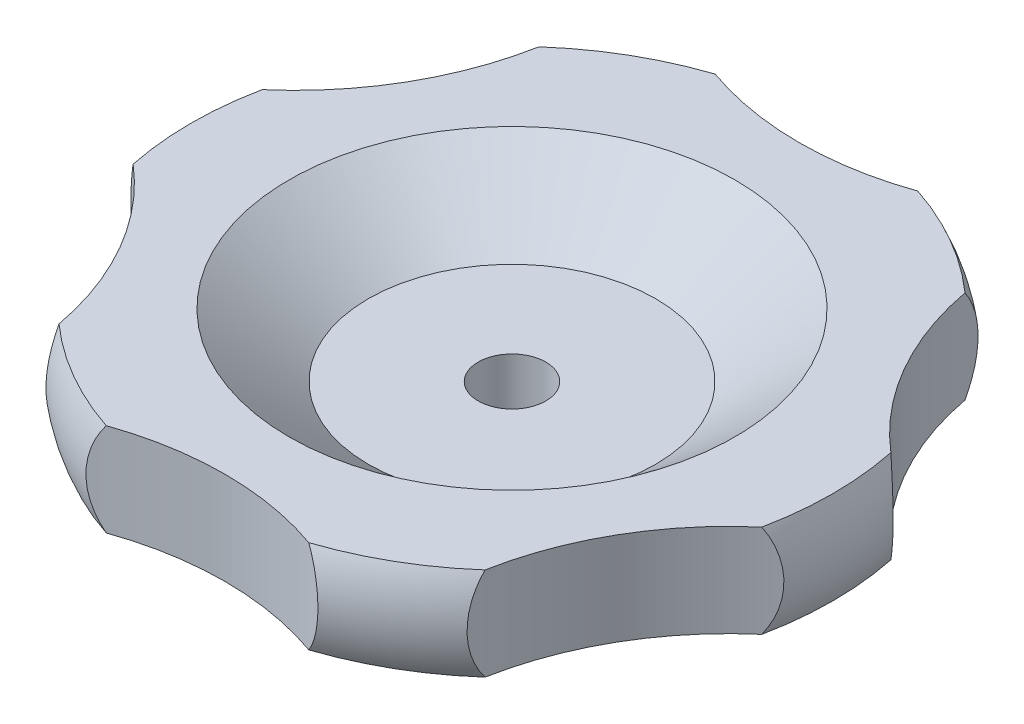
from build123d import *

# Parameters (mm, degrees)
ENL_V_MAT_EXTRU_1_DEPTH      = 59.776504379
R_P_TITION_CIRCULAIRE1_COUNT = 6


with BuildPart() as part:
    # Esquisse1 → Révolution1 (revolve)
    with BuildSketch(Plane.XY):
        with BuildLine():
            Line((-4, 12), (-4, 0))
            Line((-4, 0), (-13, 0))
            Line((-13, 0), (-13, 1.5))
            Line((-13, 1.5), (-18, 1.5))
            ThreePointArc((-18, 1.5), (-20.050252532, 6.449747468), (-25, 8.5))
            Line((-25, 8.5), (-38, 8.5))
            ThreePointArc((-38, 8.5), (-39.207317246, 14), (-38, 19.5))
            Line((-38, 19.5), (-26.383086274, 19.5))
            Line((-26.383086274, 19.5), (-17, 12))
            Line((-17, 12), (-4, 12))
        make_face()
    revolve(axis=Axis((0, 0, 0), (0, 1, 0)))

    # Esquisse2 → Enlèv. mat.-Extru.1 (cut, through all)
    with BuildSketch(Plane(origin=(0, 19.5, 0), x_dir=(1, 0, 0), z_dir=(0, 1, 0))):
        with BuildLine():
            Line((-18.717027808, -39.248205418), (0, -70))
            Line((0, -70), (18.717027808, -39.248205418))
            ThreePointArc((18.717027808, -39.248205418), (0, -34), (-18.717027808, -39.248205418))
        make_face()
    enl_v_mat_extru_1 = extrude(amount=-ENL_V_MAT_EXTRU_1_DEPTH, mode=Mode.SUBTRACT)

    # Répétition circulaire1: Enlèv. mat.-Extru.1 ×6 about axis
    r_p_tition_circulaire1_axis = Axis((0, 0, 0), (0, 1, 0))
    for i in range(1, R_P_TITION_CIRCULAIRE1_COUNT):
        add(enl_v_mat_extru_1.rotate(r_p_tition_circulaire1_axis, i * 360 / R_P_TITION_CIRCULAIRE1_COUNT), mode=Mode.SUBTRACT)


solid = part.part
